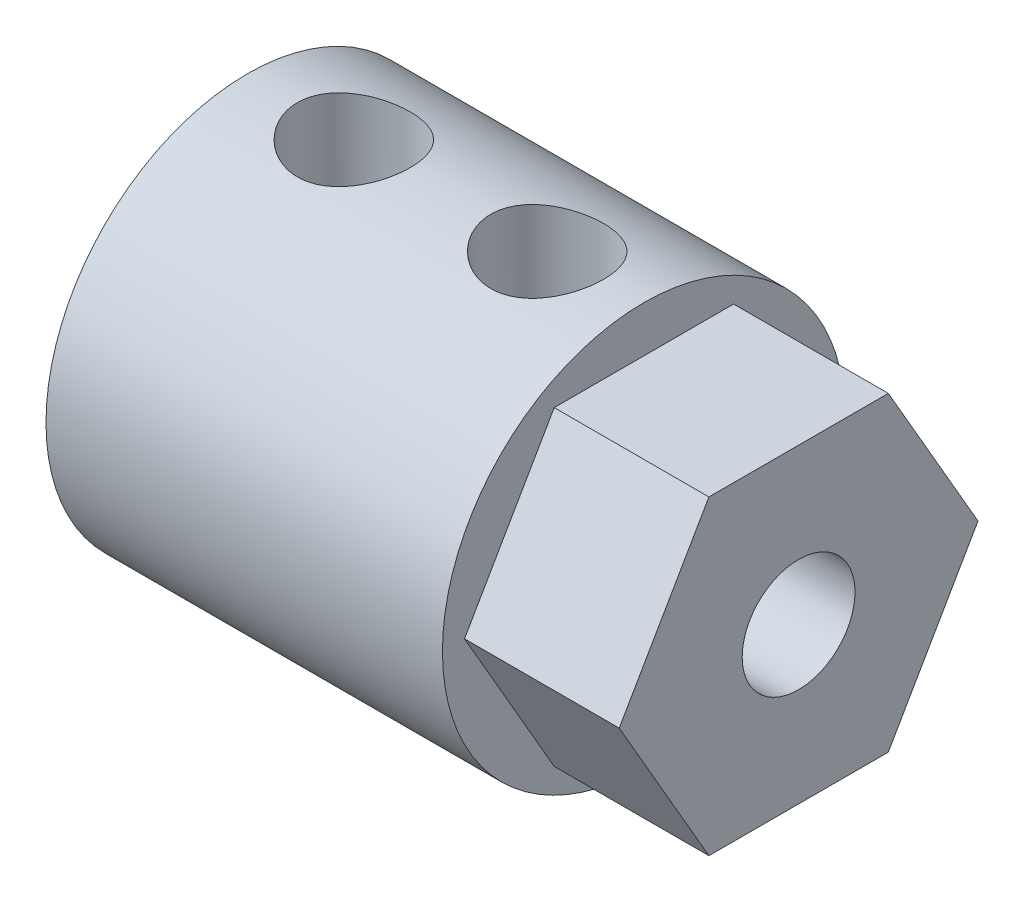
from build123d import *

# Parameters (mm, degrees)
HEX_2_DEPTH                = 6.096
SKETCH2_R                  = 7.9375
SKETCH2_R_2                = 3.2639
ROTARY_SHAFT_DEPTH         = 15.621
SKETCH3_R                  = 2.2225
SHAFT_SETSCREW_HOLES_DEPTH = 20.235993697
SKETCH4_R                  = 2.2225
CUT_EXTRUDE2_DEPTH         = 20.235993861


with BuildPart() as part:
    # Sketch1 → Hex 2 (new body)
    with BuildSketch(Plane(origin=(0, 0, 0), x_dir=(0, 0, -1), z_dir=(1, 0, 0))):
        Polygon((-3.534191938, 6.1214), (3.534191938, 6.1214), (7.068383876, 0), (3.534191938, -6.1214), (-3.534191938, -6.1214), (-7.068383876, 0), align=None)
    extrude(amount=HEX_2_DEPTH)

    # Sketch2 → Rotary_Shaft (add)
    with BuildSketch(Plane.ZY):
        with Locations(Location((0, 0, 0), (0, 0, 180))):
            Circle(SKETCH2_R)
        with Locations(Location((0, 0, 0), (0, 0, 180))):
            Circle(SKETCH2_R_2, mode=Mode.SUBTRACT)
    extrude(amount=ROTARY_SHAFT_DEPTH)

    # Sketch3 → Shaft-SetScrew-Holes (cut, through all)
    with BuildSketch(Plane(origin=(0, 0, 0), x_dir=(1, 0, 0), z_dir=(0, 1, 0))):
        with Locations(Location((-11.43, 0, 0), (0, 0, 90))):
            Circle(SKETCH3_R)
        with Locations(Location((-3.81, 0, 0), (0, 0, 90))):
            Circle(SKETCH3_R)
    extrude(amount=SHAFT_SETSCREW_HOLES_DEPTH, mode=Mode.SUBTRACT)

    # Sketch4 → Cut-Extrude2 (cut, through all)
    with BuildSketch(Plane.ZY):
        Circle(SKETCH4_R)
    extrude(amount=-CUT_EXTRUDE2_DEPTH, mode=Mode.SUBTRACT)


solid = part.part
